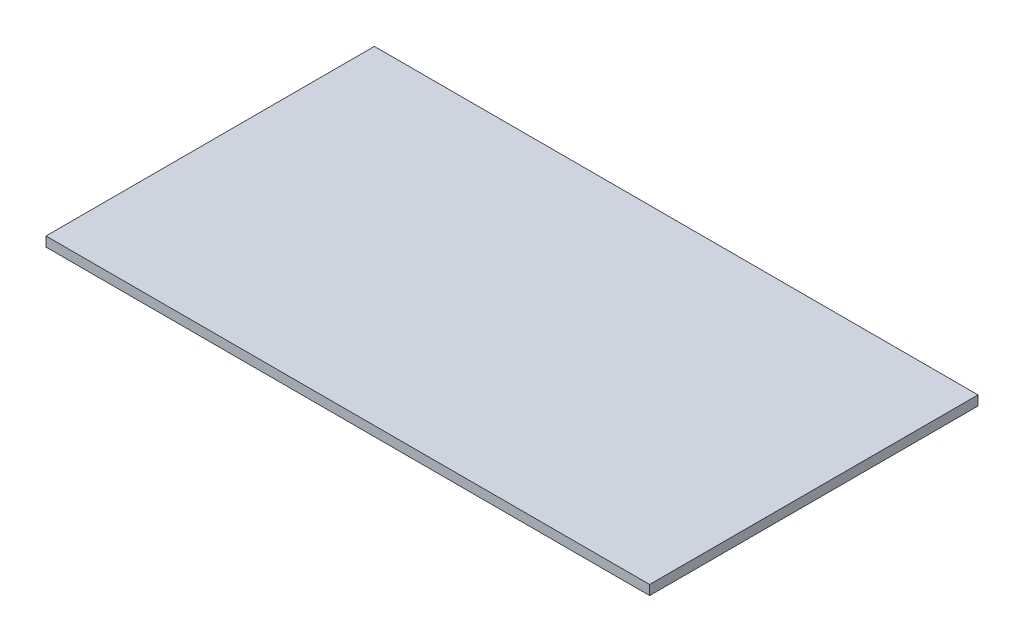
from build123d import *

# Parameters (mm, degrees)
SKETCH1_W           = 250
SKETCH1_H           = 136
BOSS_EXTRUDE1_DEPTH = 4


with BuildPart() as part:
    # Sketch1 → Boss-Extrude1 (new body)
    with BuildSketch(Plane(origin=(0, 0, 0), x_dir=(1, 0, 0), z_dir=(0, 1, 0))):
        with Locations((-7.035842294, 68)):
            Rectangle(SKETCH1_W, SKETCH1_H)
    extrude(amount=BOSS_EXTRUDE1_DEPTH)


solid = part.part
